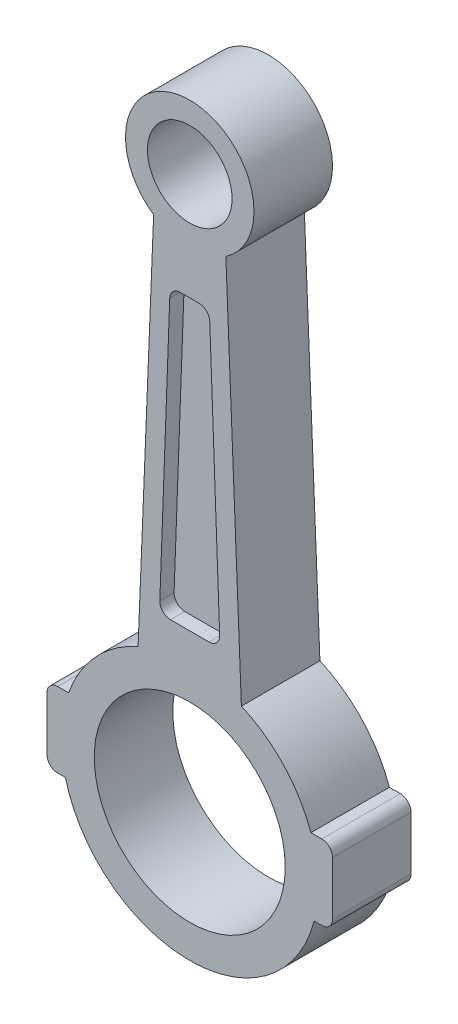
from build123d import *

# Parameters (mm, degrees)
SKETCH1_R                 = 36
BIG_END_DEPTH             = 11
SKETCH2_R                 = 18
SMALL_END_DEPTH           = 11
BEAM_DEPTH                = 11
CAP_BOLT_BOSSES_DEPTH     = 11
BEAM_START                = 7
BEAM_POCKET_FRONT_DEPTH   = 5
BEAM_START_2              = -12
BEAM_POCKET_REAR_DEPTH    = 5
BIG_END_BORE_DEPTH        = 178.709988464
BIG_END_BORE_DEPTH_BACK   = 178.709988464
SKETCH7_R                 = 26.75
SMALL_END_BORE_DEPTH      = 178.709988464
SMALL_END_BORE_DEPTH_BACK = 178.709988464
SKETCH8_R                 = 11.85


with BuildPart() as part:
    # Sketch1 → Big End (new, symmetric)
    with BuildSketch(Plane.XY):
        Circle(SKETCH1_R)
    extrude(amount=BIG_END_DEPTH, both=True)



with BuildPart() as body_2:
    # Sketch2 → Small End (new, symmetric)
    with BuildSketch(Plane.XY):
        with Locations((0, 154.8)):
            Circle(SKETCH2_R)
    extrude(amount=SMALL_END_DEPTH, both=True)


with BuildPart() as part_1:
    add(part.part)

    add(body_2.part)  # Beam merges body 2
    # Sketch3 → Beam (add, symmetric)
    with BuildSketch(Plane.XY):
        Polygon((-15, 20), (15, 20), (10, 142.8), (-10, 142.8), align=None)
    extrude(amount=BEAM_DEPTH, both=True)

    # Sketch4 → Cap Bolt Bosses (add, symmetric)
    with BuildSketch(Plane.XY):
        with BuildLine():
            Line((29, -9), (37, -9))
            ThreePointArc((37, -9), (39.121320344, -8.121320344), (40, -6))
            Line((40, -6), (40, 9))
            ThreePointArc((40, 9), (39.121320344, 11.121320344), (37, 12))
            Line((37, 12), (29, 12))
            ThreePointArc((29, 12), (26.878679656, 11.121320344), (26, 9))
            Line((26, 9), (26, -6))
            ThreePointArc((26, -6), (26.878679656, -8.121320344), (29, -9))
        make_face()
        with BuildLine():
            Line((-37, -9), (-29, -9))
            ThreePointArc((-29, -9), (-26.878679656, -8.121320344), (-26, -6))
            Line((-26, -6), (-26, 9))
            ThreePointArc((-26, 9), (-26.878679656, 11.121320344), (-29, 12))
            Line((-29, 12), (-37, 12))
            ThreePointArc((-37, 12), (-39.121320344, 11.121320344), (-40, 9))
            Line((-40, 9), (-40, -6))
            ThreePointArc((-40, -6), (-39.121320344, -8.121320344), (-37, -9))
        make_face()
    extrude(amount=CAP_BOLT_BOSSES_DEPTH, both=True)

    # Sketch5 → Beam Pocket Front (cut)
    with BuildSketch(Plane.XY.offset(BEAM_START)):
        with BuildLine():
            Line((-5.386546762, 44), (5.386546762, 44))
            ThreePointArc((5.386546762, 44), (7.546862517, 44.918405458), (8.384481085, 47.111309443))
            Line((8.384481085, 47.111309443), (5.607253362, 121.911309443))
            ThreePointArc((5.607253362, 121.911309443), (4.69091358, 123.960315756), (2.609319039, 124.8))
            Line((2.609319039, 124.8), (-2.609319039, 124.8))
            ThreePointArc((-2.609319039, 124.8), (-4.69091358, 123.960315756), (-5.607253362, 121.911309443))
            Line((-5.607253362, 121.911309443), (-8.384481085, 47.111309443))
            ThreePointArc((-8.384481085, 47.111309443), (-7.546862517, 44.918405458), (-5.386546762, 44))
        make_face()
    extrude(amount=BEAM_POCKET_FRONT_DEPTH, mode=Mode.SUBTRACT)

    # Sketch6 → Beam Pocket Rear (cut)
    with BuildSketch(Plane.XY.offset(BEAM_START_2)):
        with BuildLine():
            Line((-5.386546762, 44), (5.386546762, 44))
            ThreePointArc((5.386546762, 44), (7.546862517, 44.918405458), (8.384481085, 47.111309443))
            Line((8.384481085, 47.111309443), (5.607253362, 121.911309443))
            ThreePointArc((5.607253362, 121.911309443), (4.69091358, 123.960315756), (2.609319039, 124.8))
            Line((2.609319039, 124.8), (-2.609319039, 124.8))
            ThreePointArc((-2.609319039, 124.8), (-4.69091358, 123.960315756), (-5.607253362, 121.911309443))
            Line((-5.607253362, 121.911309443), (-8.384481085, 47.111309443))
            ThreePointArc((-8.384481085, 47.111309443), (-7.546862517, 44.918405458), (-5.386546762, 44))
        make_face()
    extrude(amount=BEAM_POCKET_REAR_DEPTH, mode=Mode.SUBTRACT)

    # Sketch7 → Big End Bore (cut, two sides: drawn at the far end of the back side and taken through both)
    with BuildSketch(Plane.XY.offset(-BIG_END_BORE_DEPTH_BACK)):
        Circle(SKETCH7_R)
    extrude(amount=BIG_END_BORE_DEPTH + BIG_END_BORE_DEPTH_BACK, mode=Mode.SUBTRACT)

    # Sketch8 → Small End Bore (cut, two sides: drawn at the far end of the back side and taken through both)
    with BuildSketch(Plane.XY.offset(-SMALL_END_BORE_DEPTH_BACK)):
        with Locations((0, 154.8)):
            Circle(SKETCH8_R)
    extrude(amount=SMALL_END_BORE_DEPTH + SMALL_END_BORE_DEPTH_BACK, mode=Mode.SUBTRACT)


solid = part_1.part
